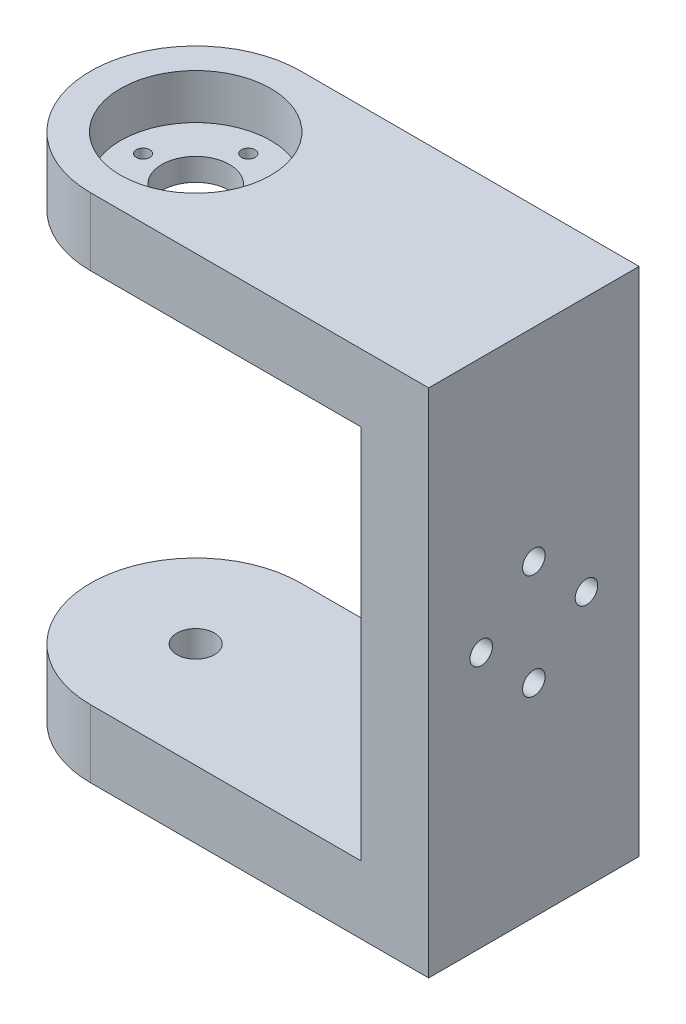
from build123d import *

# Parameters (mm, degrees)
SKETCH1_W           = 50
SKETCH1_H           = 9
SKETCH1_W_2         = 9
SKETCH1_H_2         = 68
BOSS_EXTRUDE1_DEPTH = 28
SKETCH2_R           = 2.5
CUT_EXTRUDE2_DEPTH  = 100
SKETCH4_R           = 4.5
CUT_EXTRUDE3_DEPTH  = 10
SKETCH5_R           = 10
CUT_EXTRUDE4_DEPTH  = 6
SKETCH7_R           = 1.5
CUT_EXTRUDE5_DEPTH  = 10
CUT_EXTRUDE6_DEPTH  = 10


with BuildPart() as part:
    # Sketch1 → Boss-Extrude1 (new body)
    with BuildSketch(Plane.XY):
        with Locations((-32.879310345, 31.301724138)):
            Rectangle(SKETCH1_W, SKETCH1_H)
        with Locations((-3.379310345, 1.801724138)):
            Rectangle(SKETCH1_W_2, SKETCH1_H_2)
        with Locations((-32.879310345, -27.698275862)):
            Rectangle(SKETCH1_W, SKETCH1_H)
    extrude(amount=BOSS_EXTRUDE1_DEPTH)

    # Sketch2 → Cut-Extrude2 (cut)
    with BuildSketch(Plane(origin=(0, 35.801724138, 0), x_dir=(1, 0, 0), z_dir=(0, 1, 0))):
        with Locations(Location((-43.879310345, -14, 0), (0, 0, 180))):
            Circle(SKETCH2_R)
        with BuildLine():
            ThreePointArc((-43.879310345, -28), (-53.778805281, -23.899494937), (-57.879310345, -14))
            Line((-57.879310345, -14), (-57.879310345, -28))
            Line((-57.879310345, -28), (-43.879310345, -28))
        make_face()
        with BuildLine():
            Line((-57.879310345, 0), (-57.879310345, -14))
            ThreePointArc((-57.879310345, -14), (-53.778805281, -4.100505063), (-43.879310345, 0))
            Line((-43.879310345, 0), (-57.879310345, 0))
        make_face()
    extrude(amount=-CUT_EXTRUDE2_DEPTH, mode=Mode.SUBTRACT)

    # Sketch4 → Cut-Extrude3 (cut)
    with BuildSketch(Plane(origin=(0, 35.801724138, 0), x_dir=(1, 0, 0), z_dir=(0, 1, 0))):
        with Locations(Location((-43.879310345, -14, 0), (0, 0, 180))):
            Circle(SKETCH4_R)
    extrude(amount=-CUT_EXTRUDE3_DEPTH, mode=Mode.SUBTRACT)

    # Sketch5 → Cut-Extrude4 (cut)
    with BuildSketch(Plane(origin=(0, 35.801724138, 0), x_dir=(1, 0, 0), z_dir=(0, 1, 0))):
        with Locations(Location((-43.879310345, -14, 0), (0, 0, 180))):
            Circle(SKETCH5_R)
    extrude(amount=-CUT_EXTRUDE4_DEPTH, mode=Mode.SUBTRACT)

    # Sketch7 → Cut-Extrude5 (cut)
    with BuildSketch(Plane(origin=(1.120689655, 0, 0), x_dir=(0, 0, -1), z_dir=(1, 0, 0))):
        with Locations(Location((-14, 8.801724138, 0), (0, 0, 90))):
            Circle(SKETCH7_R)
        with Locations(Location((-14, -5.198275862, 0), (0, 0, 90))):
            Circle(SKETCH7_R)
        with Locations(Location((-7, 1.801724138, 0), (0, 0, 90))):
            Circle(SKETCH7_R)
        with Locations(Location((-21, 1.801724138, 0), (0, 0, 90))):
            Circle(SKETCH7_R)
    extrude(amount=-CUT_EXTRUDE5_DEPTH, mode=Mode.SUBTRACT)

    # Sketch8 → Cut-Extrude6 (cut)
    with BuildSketch(Plane(origin=(0, 29.801724138, 0), x_dir=(1, 0, 0), z_dir=(0, 1, 0))):
        with BuildLine():
            ThreePointArc((-42.979310345, -21.003011395), (-43.242914242, -20.366615292), (-43.879310345, -20.103011395))
            Line((-43.879310345, -20.103011395), (-43.879310345, -21.903011395))
            ThreePointArc((-43.879310345, -21.903011395), (-43.242914242, -21.639407498), (-42.979310345, -21.003011395))
        make_face()
        with BuildLine():
            Line((-43.879310345, -21.903011395), (-43.879310345, -20.103011395))
            ThreePointArc((-43.879310345, -20.103011395), (-44.779310345, -21.003011395), (-43.879310345, -21.903011395))
        make_face()
        with BuildLine():
            ThreePointArc((-35.979310345, -14), (-36.879310345, -13.1), (-37.779310345, -14))
            Line((-37.779310345, -14), (-35.979310345, -14))
        make_face()
        with BuildLine():
            Line((-35.979310345, -14), (-37.779310345, -14))
            ThreePointArc((-37.779310345, -14), (-36.879310345, -14.9), (-35.979310345, -14))
        make_face()
        with BuildLine():
            ThreePointArc((-43.879310345, -6.1), (-44.779310345, -7), (-43.879310345, -7.9))
            Line((-43.879310345, -7.9), (-43.879310345, -6.1))
        make_face()
        with BuildLine():
            Line((-43.879310345, -6.1), (-43.879310345, -7.9))
            ThreePointArc((-43.879310345, -7.9), (-43.242914242, -7.636396103), (-42.979310345, -7))
            ThreePointArc((-42.979310345, -7), (-43.242914242, -6.363603897), (-43.879310345, -6.1))
        make_face()
        with BuildLine():
            ThreePointArc((-51.779310345, -14), (-50.879310345, -14.9), (-49.979310345, -14))
            Line((-49.979310345, -14), (-51.779310345, -14))
        make_face()
        with BuildLine():
            Line((-51.779310345, -14), (-49.979310345, -14))
            ThreePointArc((-49.979310345, -14), (-50.879310345, -13.1), (-51.779310345, -14))
        make_face()
    extrude(amount=-CUT_EXTRUDE6_DEPTH, mode=Mode.SUBTRACT)


solid = part.part
